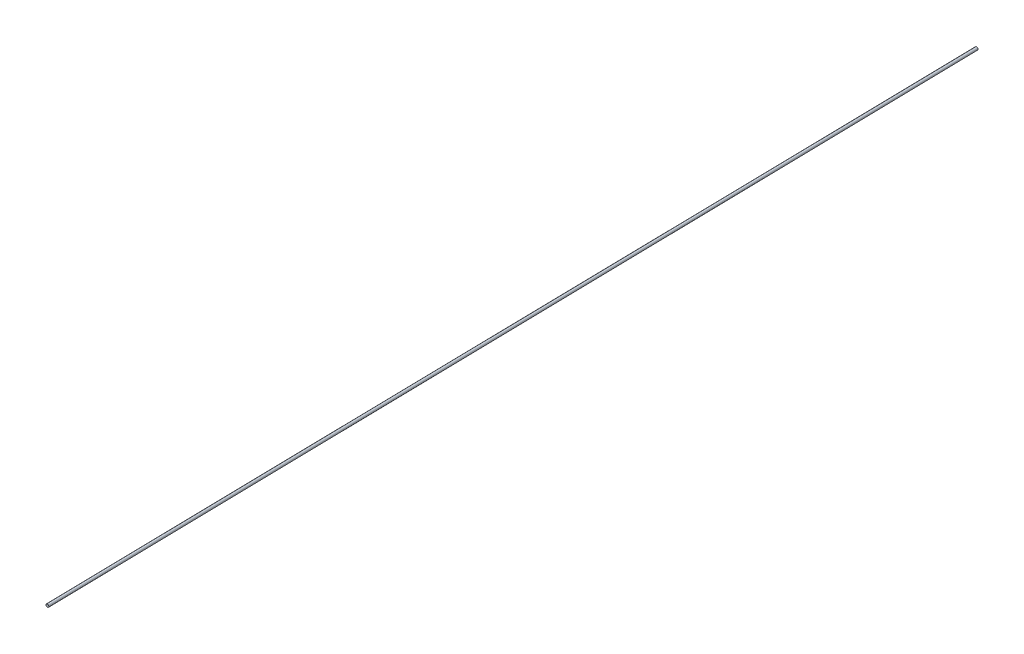
from build123d import *

# Parameters (mm, degrees)
BARRER1_PROFILE_R = 1.5


with BuildPart() as part:
    # Barrer1: sweep along a path in Croquis3
    with BuildLine(Plane(origin=(0, 0, 0), x_dir=(0, 0, -1), z_dir=(1, 0, 0))) as barrer1_path:
        Line((0, 0), (977.337030094, 18.912429944))
    # Barrer1 profile (on start of the path) → Barrer1 (sweep)
    with BuildSketch(Plane(origin=(0, 0, 0), x_dir=(0, -0.9998128223405419, -0.01934735856493379), z_dir=(0, 0.01934735856493379, -0.9998128223405419))):
        Circle(BARRER1_PROFILE_R)
    sweep(path=barrer1_path.line)


solid = part.part
